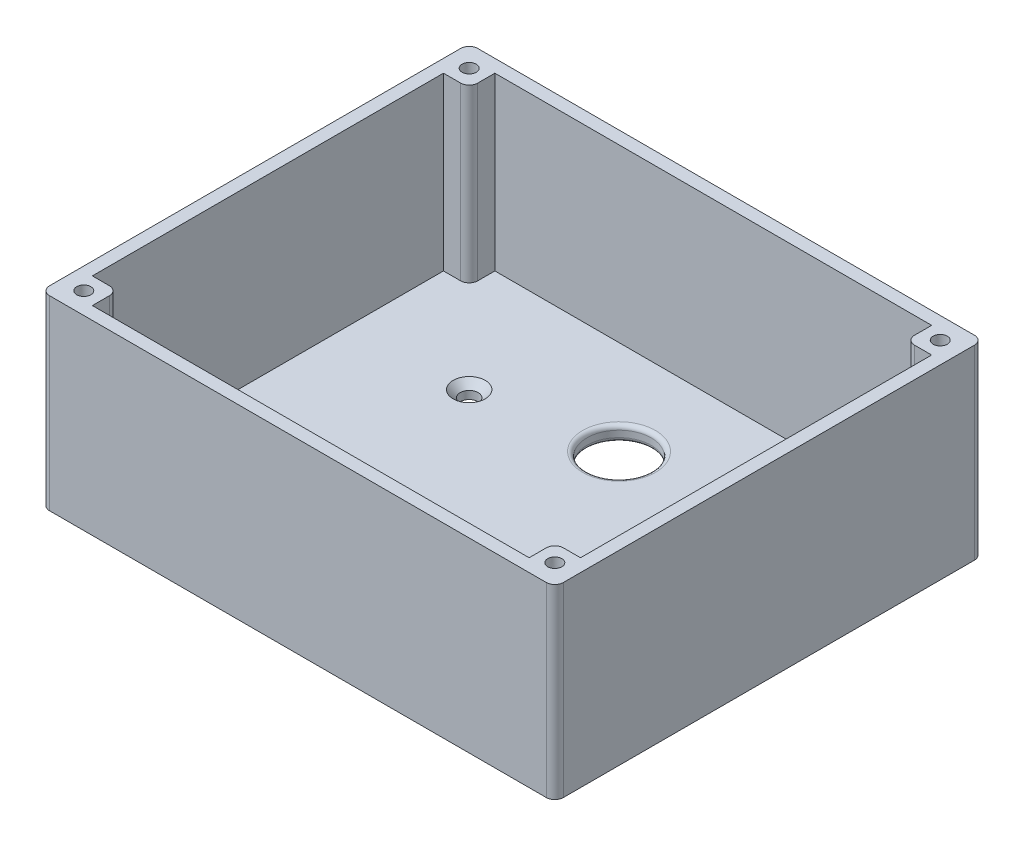
from build123d import *

# Parameters (mm, degrees)
SKETCH1_W                             = 120
SKETCH1_H                             = 100
BOTTOM_DEPTH                          = 3.5
SKETCH3_W                             = 120
SKETCH3_H                             = 100
WALL_DEPTH                            = 40
SKETCH4_R                             = 1.65
TOP_PLATE_SCREW_HOLES_DEPTH           = 30
TOP_PLATE_SCREW_HOLES_DRAFT           = -1
TOP_PLATE_SCREW_HOLES_PROFILE_2_DEPTH = 30
TOP_PLATE_SCREW_HOLES_PROFILE_2_DRAFT = -1
TOP_PLATE_SCREW_HOLES_PROFILE_3_DEPTH = 30
TOP_PLATE_SCREW_HOLES_PROFILE_3_DRAFT = -1
TOP_PLATE_SCREW_HOLES_PROFILE_4_DEPTH = 30
TOP_PLATE_SCREW_HOLES_PROFILE_4_DRAFT = -1
FILLET1_R                             = 2
FILLET2_R                             = 2
FILLET3_R                             = 2
FILLET4_R                             = 2
FILLET5_R                             = 2
FILLET6_R                             = 2
FILLET7_R                             = 2
FILLET8_R                             = 2
M4_MOUNT_R                            = 2.1
M4_MOUNT_CUT_DEPTH                    = 88.749643874
SKETCH7_R                             = 7.5
USB_CABEL_CUT_DEPTH                   = 90.399384785
FILLET9_R                             = 1
FILLET10_R                            = 1


with BuildPart() as part:
    # Sketch1 → Bottom (new body)
    with BuildSketch(Plane(origin=(0, 0, 0), x_dir=(1, 0, 0), z_dir=(0, 1, 0))):
        Rectangle(SKETCH1_W, SKETCH1_H)
    extrude(amount=BOTTOM_DEPTH)

    # Sketch3 → Wall (add)
    with BuildSketch(Plane(origin=(0, 3.5, 0), x_dir=(1, 0, 0), z_dir=(0, 1, 0))):
        Rectangle(SKETCH3_W, SKETCH3_H)
        Polygon((-51, 47), (51, 47), (51, 41), (57, 41), (57, -41), (51, -41), (51, -47), (-51, -47), (-51, -41), (-57, -41), (-57, 41), (-51, 41), align=None, mode=Mode.SUBTRACT)
    extrude(amount=WALL_DEPTH)


with BuildPart() as top_plate_screw_holes_tool:
    # Sketch4 → Top Plate Screw Holes (with draft: the straight prism first)
    with BuildSketch(Plane(origin=(0, 43.5, 0), x_dir=(1, 0, 0), z_dir=(0, 1, 0))):
        with Locations((-55, 45)):
            Circle(SKETCH4_R)
    extrude(amount=-TOP_PLATE_SCREW_HOLES_DEPTH)
    # Top Plate Screw Holes: the draft: its side faces are tilted about the plane it starts from
    top_plate_screw_holes_sides = [top_plate_screw_holes_tool.faces().sort_by_distance(p)[0] for p in [
        (-56.65, 28.5, -45),
    ]]
    draft(top_plate_screw_holes_sides, Plane(origin=(0, 43.5, 0), x_dir=(1, 0, 0), z_dir=(0, 1, 0)), TOP_PLATE_SCREW_HOLES_DRAFT)


with BuildPart() as part_1:
    add(part.part)

    # Top Plate Screw Holes: cut by top_plate_screw_holes_tool
    add(top_plate_screw_holes_tool.part, mode=Mode.SUBTRACT)


with BuildPart() as top_plate_screw_holes_profile_2_tool:
    # Sketch4 → Top Plate Screw Holes profile 2 (with draft: the straight prism first)
    with BuildSketch(Plane(origin=(0, 43.5, 0), x_dir=(1, 0, 0), z_dir=(0, 1, 0))):
        with Locations((55, 45)):
            Circle(SKETCH4_R)
    extrude(amount=-TOP_PLATE_SCREW_HOLES_PROFILE_2_DEPTH)
    # Top Plate Screw Holes profile 2: the draft: its side faces are tilted about the plane it starts from
    top_plate_screw_holes_profile_2_sides = [top_plate_screw_holes_profile_2_tool.faces().sort_by_distance(p)[0] for p in [
        (53.35, 28.5, -45),
    ]]
    draft(top_plate_screw_holes_profile_2_sides, Plane(origin=(0, 43.5, 0), x_dir=(1, 0, 0), z_dir=(0, 1, 0)), TOP_PLATE_SCREW_HOLES_PROFILE_2_DRAFT)


with BuildPart() as part_2:
    add(part_1.part)

    # Top Plate Screw Holes profile 2: cut by top_plate_screw_holes_profile_2_tool
    add(top_plate_screw_holes_profile_2_tool.part, mode=Mode.SUBTRACT)


with BuildPart() as top_plate_screw_holes_profile_3_tool:
    # Sketch4 → Top Plate Screw Holes profile 3 (with draft: the straight prism first)
    with BuildSketch(Plane(origin=(0, 43.5, 0), x_dir=(1, 0, 0), z_dir=(0, 1, 0))):
        with Locations((55, -45)):
            Circle(SKETCH4_R)
    extrude(amount=-TOP_PLATE_SCREW_HOLES_PROFILE_3_DEPTH)
    # Top Plate Screw Holes profile 3: the draft: its side faces are tilted about the plane it starts from
    top_plate_screw_holes_profile_3_sides = [top_plate_screw_holes_profile_3_tool.faces().sort_by_distance(p)[0] for p in [
        (53.35, 28.5, 45),
    ]]
    draft(top_plate_screw_holes_profile_3_sides, Plane(origin=(0, 43.5, 0), x_dir=(1, 0, 0), z_dir=(0, 1, 0)), TOP_PLATE_SCREW_HOLES_PROFILE_3_DRAFT)


with BuildPart() as part_3:
    add(part_2.part)

    # Top Plate Screw Holes profile 3: cut by top_plate_screw_holes_profile_3_tool
    add(top_plate_screw_holes_profile_3_tool.part, mode=Mode.SUBTRACT)


with BuildPart() as top_plate_screw_holes_profile_4_tool:
    # Sketch4 → Top Plate Screw Holes profile 4 (with draft: the straight prism first)
    with BuildSketch(Plane(origin=(0, 43.5, 0), x_dir=(1, 0, 0), z_dir=(0, 1, 0))):
        with Locations((-55, -45)):
            Circle(SKETCH4_R)
    extrude(amount=-TOP_PLATE_SCREW_HOLES_PROFILE_4_DEPTH)
    # Top Plate Screw Holes profile 4: the draft: its side faces are tilted about the plane it starts from
    top_plate_screw_holes_profile_4_sides = [top_plate_screw_holes_profile_4_tool.faces().sort_by_distance(p)[0] for p in [
        (-56.65, 28.5, 45),
    ]]
    draft(top_plate_screw_holes_profile_4_sides, Plane(origin=(0, 43.5, 0), x_dir=(1, 0, 0), z_dir=(0, 1, 0)), TOP_PLATE_SCREW_HOLES_PROFILE_4_DRAFT)


with BuildPart() as part_4:
    add(part_3.part)

    # Top Plate Screw Holes profile 4: cut by top_plate_screw_holes_profile_4_tool
    add(top_plate_screw_holes_profile_4_tool.part, mode=Mode.SUBTRACT)

    # Fillet1
    fillet1_edges = [part_4.edges().sort_by_distance(p)[0] for p in [
        (-51, 23.5, 41),
    ]]
    fillet(fillet1_edges, radius=FILLET1_R)

    # Fillet2
    fillet2_edges = [part_4.edges().sort_by_distance(p)[0] for p in [
        (51, 23.5, 41),
    ]]
    fillet(fillet2_edges, radius=FILLET2_R)

    # Fillet3
    fillet3_edges = [part_4.edges().sort_by_distance(p)[0] for p in [
        (51, 23.5, -41),
    ]]
    fillet(fillet3_edges, radius=FILLET3_R)

    # Fillet4
    fillet4_edges = [part_4.edges().sort_by_distance(p)[0] for p in [
        (-51, 23.5, -41),
    ]]
    fillet(fillet4_edges, radius=FILLET4_R)

    # Fillet5
    fillet5_edges = [part_4.edges().sort_by_distance(p)[0] for p in [
        (-60, 21.75, -50),
    ]]
    fillet(fillet5_edges, radius=FILLET5_R)

    # Fillet6
    fillet6_edges = [part_4.edges().sort_by_distance(p)[0] for p in [
        (60, 21.75, -50),
    ]]
    fillet(fillet6_edges, radius=FILLET6_R)

    # Fillet7
    fillet7_edges = [part_4.edges().sort_by_distance(p)[0] for p in [
        (60, 21.75, 50),
    ]]
    fillet(fillet7_edges, radius=FILLET7_R)

    # Fillet8
    fillet8_edges = [part_4.edges().sort_by_distance(p)[0] for p in [
        (-60, 21.75, 50),
    ]]
    fillet(fillet8_edges, radius=FILLET8_R)

    # M4 Mount → M4 Mount Cut (cut, through all)
    with BuildSketch(Plane.XZ.offset(-3.5)):
        with Locations(Location((30, -20, 0), (0, 0, 270))):
            Circle(M4_MOUNT_R)
        with Locations(Location((30, 20, 0), (0, 0, 270))):
            Circle(M4_MOUNT_R)
        with Locations(Location((-30, 20, 0), (0, 0, 90))):
            Circle(M4_MOUNT_R)
        with Locations(Location((-30, -20, 0), (0, 0, 90))):
            Circle(M4_MOUNT_R)
    extrude(amount=M4_MOUNT_CUT_DEPTH, mode=Mode.SUBTRACT)

    # Cut-Extrude3 cone 1 section (through the dimple's axis) → Cut-Extrude3 (revolve, cut)
    with BuildSketch(Plane(origin=(30, 3.5, 20), x_dir=(0, 0, 1), z_dir=(1, 0, 0))):
        Polygon((0, 0), (3.75, 0), (0, 3.75), align=None)
    revolve(axis=Axis((30, 3.5, 20), (0, -1, 0)), mode=Mode.SUBTRACT)

    # Cut-Extrude3 cone 2 section (through the dimple's axis) → Cut-Extrude3 cone 2 (revolve, cut)
    with BuildSketch(Plane(origin=(30, 3.5, -20), x_dir=(0, 0, 1), z_dir=(1, 0, 0))):
        Polygon((0, 0), (3.75, 0), (0, 3.75), align=None)
    revolve(axis=Axis((30, 3.5, -20), (0, -1, 0)), mode=Mode.SUBTRACT)

    # Cut-Extrude3 cone 3 section (through the dimple's axis) → Cut-Extrude3 cone 3 (revolve, cut)
    with BuildSketch(Plane(origin=(-30, 3.5, -20), x_dir=(0, 0, 1), z_dir=(1, 0, 0))):
        Polygon((0, 0), (3.75, 0), (0, 3.75), align=None)
    revolve(axis=Axis((-30, 3.5, -20), (0, -1, 0)), mode=Mode.SUBTRACT)

    # Cut-Extrude3 cone 4 section (through the dimple's axis) → Cut-Extrude3 cone 4 (revolve, cut)
    with BuildSketch(Plane(origin=(-30, 3.5, 20), x_dir=(0, 0, 1), z_dir=(1, 0, 0))):
        Polygon((0, 0), (3.75, 0), (0, 3.75), align=None)
    revolve(axis=Axis((-30, 3.5, 20), (0, -1, 0)), mode=Mode.SUBTRACT)

    # Sketch7 → USB Cabel Cut (cut, through all)
    with BuildSketch(Plane.XZ):
        with Locations(Location((0, -25, 0), (0, 0, 270))):
            Circle(SKETCH7_R)
    extrude(amount=-USB_CABEL_CUT_DEPTH, mode=Mode.SUBTRACT)

    # Fillet9
    fillet9_edges = [part_4.edges().sort_by_distance(p)[0] for p in [
        (0, 0, -17.5),
    ]]
    fillet(fillet9_edges, radius=FILLET9_R)

    # Fillet10
    fillet10_edges = [part_4.edges().sort_by_distance(p)[0] for p in [
        (0, 3.5, -17.5),
    ]]
    fillet(fillet10_edges, radius=FILLET10_R)


solid = part_4.part
